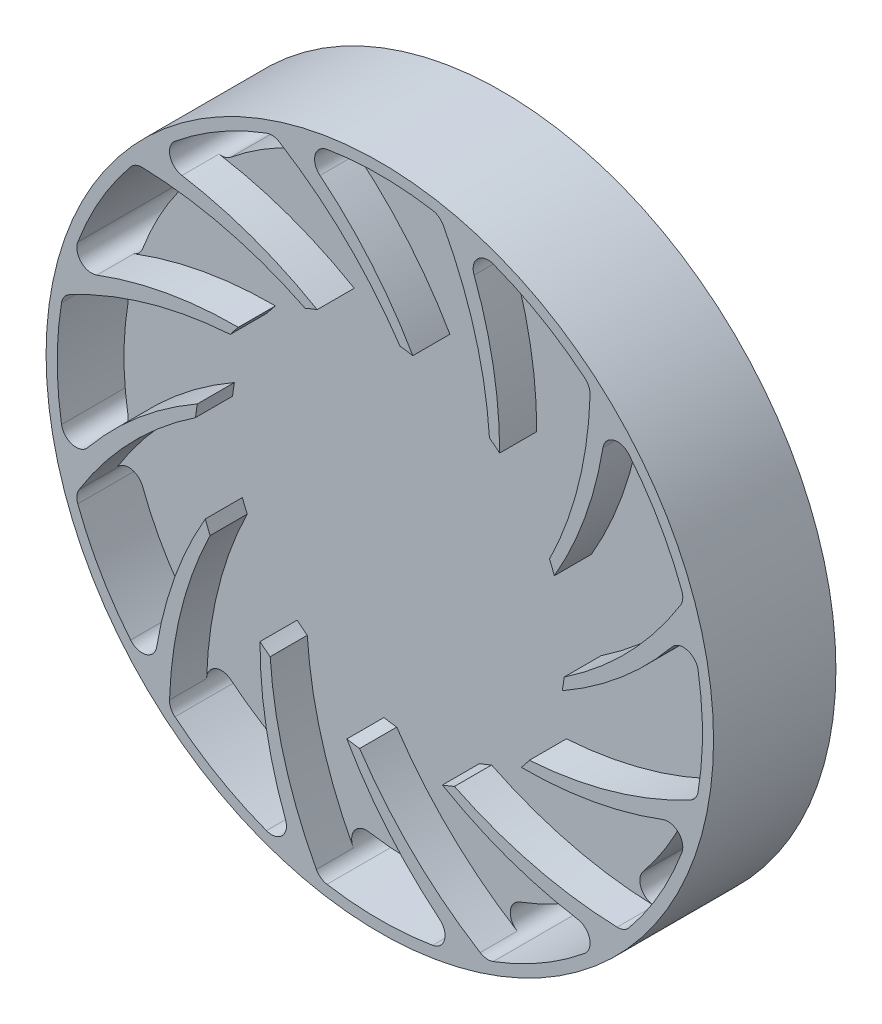
from build123d import *

# Parameters (mm, degrees)
CUT_EXTRUDE3_DEPTH = 10
CUT_EXTRUDE4_DEPTH = 132.487642005
CUT_EXTRUDE5_START = -28
CUT_EXTRUDE5_DEPTH = 5
CIRPATTERN3_COUNT  = 12
CUT_EXTRUDE2_DEPTH = 5
CIRPATTERN2_COUNT  = 12


with BuildPart() as part:
    # Sketch4 → Revolve1 (revolve)
    with BuildSketch(Plane.YZ, mode=Mode.PRIVATE) as revolve1_sk:
        Polygon((-90, 10), (-90, -23), (-75, -23), (-75, -3), (0, -3), (0, 0), (-50, 0), (-50, 10), align=None)
    revolve(revolve1_sk.sketch.rotate(Axis((0, 0, -31.506906469), (0, 0, 1)), 270), axis=Axis((0, 0, -31.506906469), (0, 0, 1)))

    # Sketch6 → Cut-Extrude3 (cut)
    with BuildSketch(Plane.XY.offset(10)):
        with BuildLine():
            ThreePointArc((8.897861056, 49.201911229), (19.73783126, 45.939286206), (29.566042792, 40.321819324))
            ThreePointArc((29.566042792, 40.321819324), (25.66939886, 62.715092432), (17.112350617, 83.772619347))
            ThreePointArc((17.112350617, 83.772619347), (15.916441921, 85.132831951), (14.243221977, 85.82616517))
            ThreePointArc((14.243221977, 85.82616517), (0, 87), (-14.243221977, 85.82616517))
            ThreePointArc((-14.243221977, 85.82616517), (-17.453140754, 82.911385755), (-16.122060076, 78.78491731))
            ThreePointArc((-16.122060076, 78.78491731), (-2.256365152, 65.140030899), (8.897861056, 49.201911229))
        make_face()
    cut_extrude3 = extrude(amount=-CUT_EXTRUDE3_DEPTH, mode=Mode.SUBTRACT)

    # Sketch6<4> → Cut-Extrude4 (cut, through all)
    with BuildSketch(Plane.XY.offset(10)):
        with BuildLine():
            ThreePointArc((12.933500416, 77.934104005), (15.836477489, 78.571664679), (17.498247146, 81.035864571))
            ThreePointArc((17.498247146, 81.035864571), (17.5491796, 82.438630397), (17.112350617, 83.772619347))
            ThreePointArc((17.112350617, 83.772619347), (15.916441921, 85.132831951), (14.243221977, 85.82616517))
            ThreePointArc((14.243221977, 85.82616517), (0, 87), (-14.243221977, 85.82616517))
            ThreePointArc((-14.243221977, 85.82616517), (-16.896831105, 84.12825088), (-17.498247146, 81.035864571))
            ThreePointArc((-17.498247146, 81.035864571), (-17.001078187, 79.793663225), (-16.122060076, 78.78491731))
            ThreePointArc((-16.122060076, 78.78491731), (-14.619612364, 78.015355029), (-12.933500416, 77.934104005))
            ThreePointArc((-12.933500416, 77.934104005), (0, 79), (12.933500416, 77.934104005))
        make_face()
    cut_extrude4 = extrude(amount=-CUT_EXTRUDE4_DEPTH, mode=Mode.SUBTRACT)

    # Sketch6<7> → Cut-Extrude5 (cut)
    with BuildSketch(Plane.XY.offset(10).offset(CUT_EXTRUDE5_START)):
        with BuildLine():
            Line((-17.498247146, 81.035864571), (-17.200261768, 79.655869045))
            ThreePointArc((-17.200261768, 79.655869045), (-16.659744939, 79.222146104), (-16.122060076, 78.78491731))
            ThreePointArc((-16.122060076, 78.78491731), (-17.001078187, 79.793663225), (-17.498247146, 81.035864571))
        make_face()
        with BuildLine():
            Line((-17.200261768, 79.655869045), (-10.553375198, 48.873574372))
            ThreePointArc((-10.553375198, 48.873574372), (-0.843879755, 49.992878162), (8.897861056, 49.201911229))
            ThreePointArc((8.897861056, 49.201911229), (-2.256365152, 65.140030899), (-16.122060076, 78.78491731))
            ThreePointArc((-16.122060076, 78.78491731), (-16.659744939, 79.222146104), (-17.200261768, 79.655869045))
        make_face()
        with BuildLine():
            ThreePointArc((8.897861056, 49.201911229), (9.72700361, 49.044728573), (10.553375198, 48.873574372))
            Line((10.553375198, 48.873574372), (17.498247146, 81.035864571))
            ThreePointArc((17.498247146, 81.035864571), (15.836477489, 78.571664679), (12.933500416, 77.934104005))
            ThreePointArc((12.933500416, 77.934104005), (0, 79), (-12.933500416, 77.934104005))
            ThreePointArc((-12.933500416, 77.934104005), (-14.619612364, 78.015355029), (-16.122060076, 78.78491731))
            ThreePointArc((-16.122060076, 78.78491731), (-2.256365152, 65.140030899), (8.897861056, 49.201911229))
        make_face()
        with BuildLine():
            Line((2.11067504, 9.774714874), (0, 0))
            Line((0, 0), (-2.11067504, 9.774714874))
            Line((-2.11067504, 9.774714874), (-10.553375198, 48.873574372))
            ThreePointArc((-10.553375198, 48.873574372), (-31.403274034, -38.908024621), (50, 0))
            ThreePointArc((50, 0), (44.599899885, 22.601967397), (29.566042792, 40.321819324))
            ThreePointArc((29.566042792, 40.321819324), (20.51036454, 45.599615639), (10.553375198, 48.873574372))
            Line((10.553375198, 48.873574372), (2.11067504, 9.774714874))
        make_face()
        with BuildLine():
            ThreePointArc((1.858998352, 9.825687005), (1.985000315, 9.801008813), (2.11067504, 9.774714874))
            Line((2.11067504, 9.774714874), (10.553375198, 48.873574372))
            ThreePointArc((10.553375198, 48.873574372), (9.72700361, 49.044728573), (8.897861056, 49.201911229))
            ThreePointArc((8.897861056, 49.201911229), (-0.843879755, 49.992878162), (-10.553375198, 48.873574372))
            Line((-10.553375198, 48.873574372), (-2.11067504, 9.774714874))
            ThreePointArc((-2.11067504, 9.774714874), (-0.168775951, 9.998575632), (1.779572211, 9.840382246))
            ThreePointArc((1.779572211, 9.840382246), (1.819300119, 9.833114821), (1.858998352, 9.825687005))
        make_face()
    cut_extrude5 = extrude(amount=-CUT_EXTRUDE5_DEPTH, mode=Mode.SUBTRACT)

    # CirPattern3: Cut-Extrude3, Cut-Extrude4, Cut-Extrude5 ×12 about axis
    cirpattern3_axis = Axis((0, 0, 0), (0, 0, 1))
    add([cut_extrude3.rotate(cirpattern3_axis, i * 360 / CIRPATTERN3_COUNT) for i in range(1, CIRPATTERN3_COUNT)], mode=Mode.SUBTRACT)
    add([cut_extrude4.rotate(cirpattern3_axis, i * 360 / CIRPATTERN3_COUNT) for i in range(1, CIRPATTERN3_COUNT)], mode=Mode.SUBTRACT)
    add([cut_extrude5.rotate(cirpattern3_axis, i * 360 / CIRPATTERN3_COUNT) for i in range(1, CIRPATTERN3_COUNT)], mode=Mode.SUBTRACT)

    # Sketch1 → Cut-Extrude2 (cut)
    with BuildSketch(Plane(origin=(0, 0, 0), x_dir=(0, 1, 0), z_dir=(0, 0, 1))):
        with BuildLine():
            ThreePointArc((-11.51384086, 80.076472629), (-13.694407103, 80.611825241), (-14.892670299, 82.510676702))
            Line((-14.892670299, 82.510676702), (-3.124055826, 17.608519467))
            ThreePointArc((-3.124055826, 17.608519467), (0, 15), (3.124055826, 17.608519467))
            Line((3.124055826, 17.608519467), (14.892670326, 82.510676853))
            ThreePointArc((14.892670326, 82.510676853), (13.694407165, 80.611825286), (11.51384086, 80.076472629))
            ThreePointArc((11.51384086, 80.076472629), (0, 80.9), (-11.51384086, 80.076472629))
        make_face()
    extrude(amount=CUT_EXTRUDE2_DEPTH, mode=Mode.SUBTRACT)

    # CirPattern2: part ×12 about axis
    cirpattern2_axis = Axis((0, 0, -31.506906469), (0, 0, 1))


with BuildPart() as part_1:
    add(part.part)
    for i in range(1, CIRPATTERN2_COUNT):
        add(part.part.rotate(cirpattern2_axis, i * 360 / CIRPATTERN2_COUNT))


solid = part_1.part
